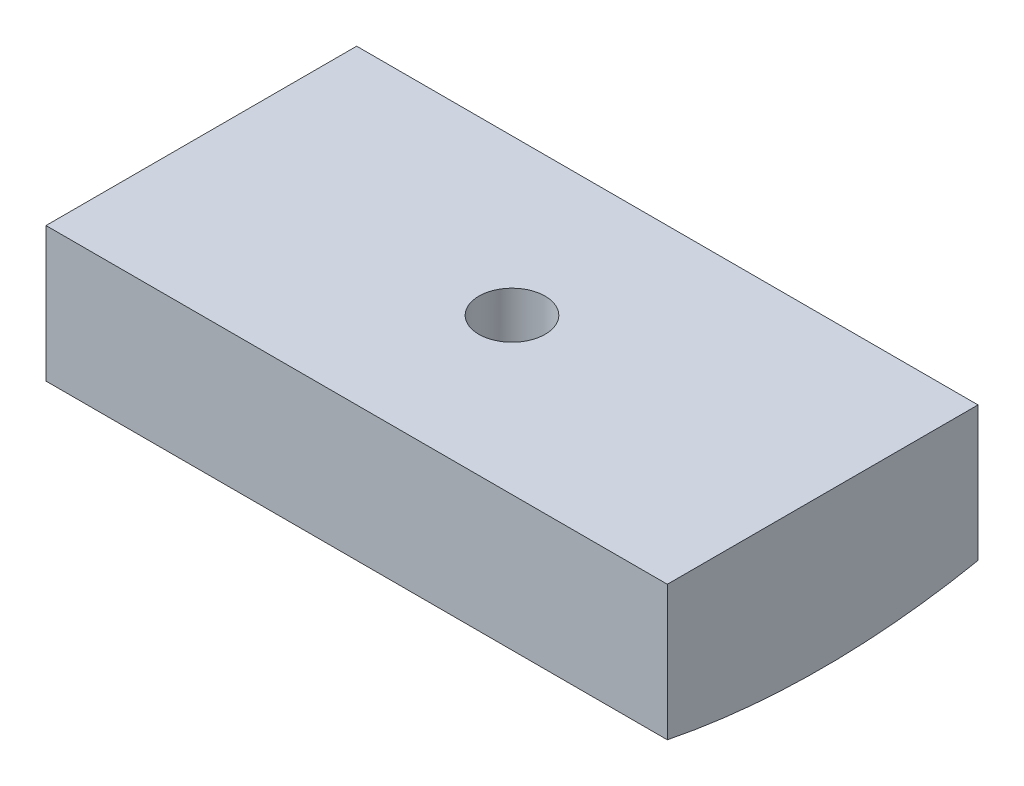
from build123d import *

# Parameters (mm, degrees)
BOSS_EXTRUDE1_DEPTH = 60
SKETCH2_R           = 3.2
CUT_EXTRUDE1_DEPTH  = 64.523617655


with BuildPart() as part:
    # Sketch1 → Boss-Extrude1 (new body)
    with BuildSketch(Plane(origin=(0, 0, 0), x_dir=(0, 0, -1), z_dir=(1, 0, 0))):
        with BuildLine():
            Line((-15, -61.79), (15, -61.79))
            Line((15, -61.79), (15, -74.800829541))
            ThreePointArc((15, -74.800829541), (0, -76.29), (-15, -74.800829541))
            Line((-15, -74.800829541), (-15, -61.79))
        make_face()
    extrude(amount=BOSS_EXTRUDE1_DEPTH)

    # Sketch2 → Cut-Extrude1 (cut, through all)
    with BuildSketch(Plane(origin=(0, -61.79, 0), x_dir=(1, 0, 0), z_dir=(0, 1, 0))):
        with Locations(Location((30, 0, 0), (0, 0, 270))):
            Circle(SKETCH2_R)
    extrude(amount=-CUT_EXTRUDE1_DEPTH, mode=Mode.SUBTRACT)


solid = part.part
